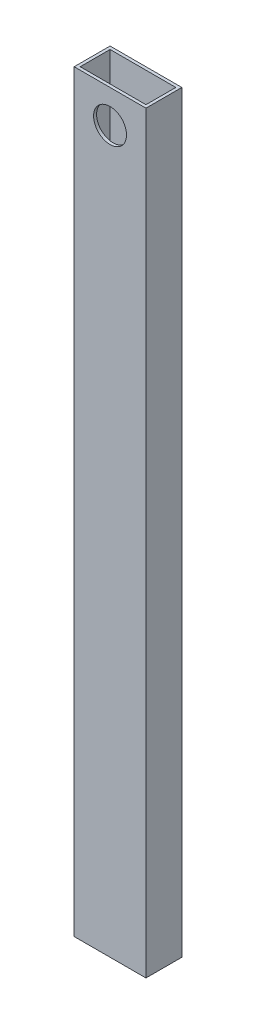
from build123d import *

# Parameters (mm, degrees)
EXTRUDE_THIN1_DEPTH            = 510
EXTRUDE_THIN1_DEPTH_BACK       = 290
SKETCH1_W                      = 76.2
SKETCH1_H                      = 38.1
SKETCH1_W_2                    = 69.85
SKETCH1_H_2                    = 31.75
F_12_0_12_DIAMETER_HOLE1_D     = 12
F_12_0_12_DIAMETER_HOLE1_DEPTH = 3.175
CUT_EXTRUDE1_REACH             = 514.838
SKETCH6_R                      = 17.5
CUT_EXTRUDE2_REACH             = 514.838
SKETCH7_R                      = 17.5


with BuildPart() as part:
    # Sketch1 → Extrude-Thin1 (new, two sides: drawn at the far end of the back side and taken through both)
    with BuildSketch(Plane(origin=(0, 0, 0), x_dir=(1, 0, 0), z_dir=(0, 1, 0)).offset(-EXTRUDE_THIN1_DEPTH_BACK)):
        Rectangle(SKETCH1_W, SKETCH1_H)
        Rectangle(SKETCH1_W_2, SKETCH1_H_2, mode=Mode.SUBTRACT)
    extrude(amount=EXTRUDE_THIN1_DEPTH + EXTRUDE_THIN1_DEPTH_BACK)

    # Ø12.0 (12) Diameter Hole1
    with Locations(Plane(origin=(0, 0, -19.05), x_dir=(-1, 0, 0), z_dir=(0, 0, -1))):
        with Locations((-20, -25), (20, -275), (-20, -275), (20, -25)):
            Hole(F_12_0_12_DIAMETER_HOLE1_D / 2, depth=F_12_0_12_DIAMETER_HOLE1_DEPTH)

    # Sketch6 → Cut-Extrude1 (cut, up to next)
    with BuildSketch(Plane.XY.offset(19.05), mode=Mode.PRIVATE) as cut_extrude1_sk1:
        with Locations((0, 475)):
            Circle(SKETCH6_R)
    cut_extrude1_tool1 = extrude(cut_extrude1_sk1.sketch, amount=-CUT_EXTRUDE1_REACH, mode=Mode.PRIVATE) & part.part
    add(cut_extrude1_tool1.solids().sort_by_distance((0, 475, 19.05))[0], mode=Mode.SUBTRACT)

    # Sketch7 → Cut-Extrude2 (cut, up to next)
    with BuildSketch(Plane(origin=(0, 0, -19.05), x_dir=(-1, 0, 0), z_dir=(0, 0, -1)), mode=Mode.PRIVATE) as cut_extrude2_sk1:
        with Locations((0, -75)):
            Circle(SKETCH7_R)
    cut_extrude2_tool1 = extrude(cut_extrude2_sk1.sketch, amount=-CUT_EXTRUDE2_REACH, mode=Mode.PRIVATE) & part.part
    add(cut_extrude2_tool1.solids().sort_by_distance((0, -75, -19.05))[0], mode=Mode.SUBTRACT)


solid = part.part
